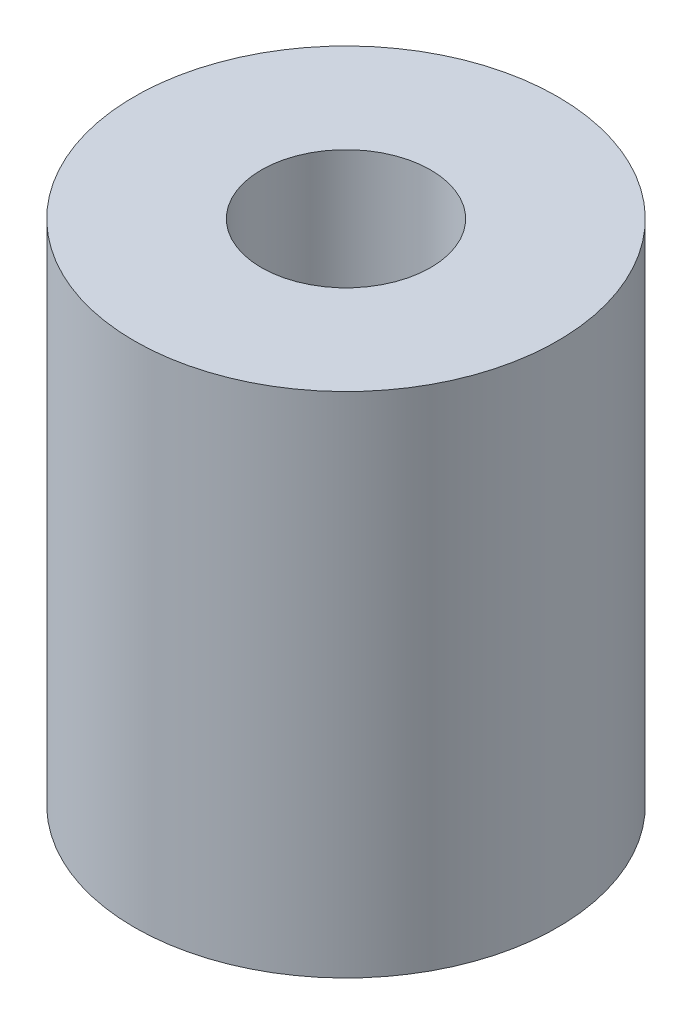
from build123d import *

# Parameters (mm, degrees)
SKETCH1_R                      = 12.5
BOSS_EXTRUDE1_DEPTH            = 30
F_10_0_10_DIAMETER_HOLE1_D     = 10
F_10_0_10_DIAMETER_HOLE1_DEPTH = 15
F_10_0_10_DIAMETER_HOLE1_TIP   = 3.004303095
F_8_0_8_DIAMETER_HOLE1_D       = 8
F_8_0_8_DIAMETER_HOLE1_DEPTH   = 15
F_8_0_8_DIAMETER_HOLE1_TIP     = 2.403442476


with BuildPart() as part:
    # Sketch1 → Boss-Extrude1 (new body)
    with BuildSketch(Plane(origin=(0, 0, 0), x_dir=(1, 0, 0), z_dir=(0, 1, 0))):
        with Locations(Location((0, 0, 0), (0, 0, 270))):
            Circle(SKETCH1_R)
    extrude(amount=BOSS_EXTRUDE1_DEPTH)

    # Ø10.0 (10) Diameter Hole1
    with Locations(Plane(origin=(0, 30, 0), x_dir=(1, 0, 0), z_dir=(0, 1, 0))):
        with Locations((0, 0)):
            Hole(F_10_0_10_DIAMETER_HOLE1_D / 2, depth=F_10_0_10_DIAMETER_HOLE1_DEPTH)
            with Locations((0, 0, -(F_10_0_10_DIAMETER_HOLE1_DEPTH + F_10_0_10_DIAMETER_HOLE1_TIP / 2))):  # 118° drill point
                Cone(0, F_10_0_10_DIAMETER_HOLE1_D / 2, F_10_0_10_DIAMETER_HOLE1_TIP, mode=Mode.SUBTRACT)

    # Ø8.0 (8) Diameter Hole1
    with Locations(Plane(origin=(0, 0, 0), x_dir=(-1, 0, 0), z_dir=(0, -1, 0))):
        with Locations((0, 0)):
            Hole(F_8_0_8_DIAMETER_HOLE1_D / 2, depth=F_8_0_8_DIAMETER_HOLE1_DEPTH)
            with Locations((0, 0, -(F_8_0_8_DIAMETER_HOLE1_DEPTH + F_8_0_8_DIAMETER_HOLE1_TIP / 2))):  # 118° drill point
                Cone(0, F_8_0_8_DIAMETER_HOLE1_D / 2, F_8_0_8_DIAMETER_HOLE1_TIP, mode=Mode.SUBTRACT)


solid = part.part
